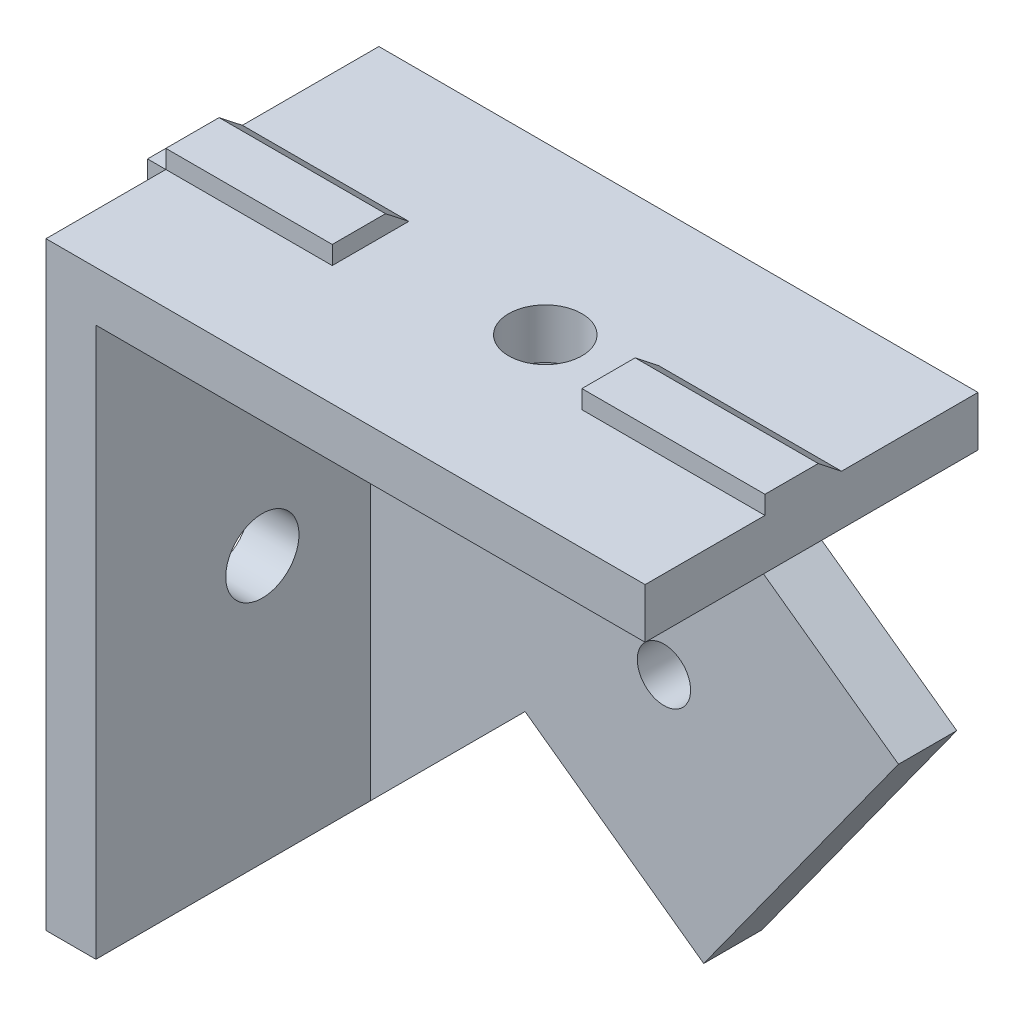
from build123d import *

# Parameters (mm, degrees)
BOSS_EXTRUDE1_DEPTH = 3.5
BOSS_EXTRUDE2_DEPTH = 16.5
SKETCH4_R           = 2.2
CUT_EXTRUDE1_DEPTH  = 53.773099208
SKETCH5_R           = 2.2
CUT_EXTRUDE2_DEPTH  = 53.773099208
BOSS_EXTRUDE5_DEPTH = 36
SKETCH7_W           = 15
SKETCH7_H           = 1.1
CUT_EXTRUDE3_DEPTH  = 53.496095093
BOSS_EXTRUDE6_REACH = 57.429
SKETCH9_W           = 1.1
SKETCH9_H           = 15
CUT_EXTRUDE4_DEPTH  = 53.496095093
BOSS_EXTRUDE7_DEPTH = 3.5
SKETCH11_R          = 1.6
CUT_EXTRUDE5_DEPTH  = 54.518688325


with BuildPart() as part:
    # Sketch1 → Boss-Extrude1 (new body)
    with BuildSketch(Plane.XY):
        Polygon((0, -36), (0, 0), (36, 0), (36, -3), (3, -36), align=None)
    extrude(amount=BOSS_EXTRUDE1_DEPTH)

    # Sketch2 → Boss-Extrude2 (add)
    with BuildSketch(Plane.XY.offset(3.5)):
        Polygon((0, -36), (0, 0), (36, 0), (36, -3), (3, -3), (3, -36), align=None)
    extrude(amount=BOSS_EXTRUDE2_DEPTH)

    # Sketch4 → Cut-Extrude1 (cut, through all)
    with BuildSketch(Plane.XZ.offset(3)):
        with Locations(Location((20, 10, 0), (0, 0, 270))):
            Circle(SKETCH4_R)
    extrude(amount=-CUT_EXTRUDE1_DEPTH, mode=Mode.SUBTRACT)

    # Sketch5 → Cut-Extrude2 (cut, through all)
    with BuildSketch(Plane(origin=(3, 0, 0), x_dir=(0, 0, -1), z_dir=(1, 0, 0))):
        with Locations((-10, -20)):
            Circle(SKETCH5_R)
    extrude(amount=-CUT_EXTRUDE2_DEPTH, mode=Mode.SUBTRACT)

    # Sketch6 → Boss-Extrude5 (add, through all)
    with BuildSketch(Plane(origin=(36, 0, 0), x_dir=(0, 0, -1), z_dir=(1, 0, 0))):
        Polygon((-12.8, 0), (-12.8, 1.1), (-9.6, 1.1), (-8.2, 0), align=None)
    extrude(amount=-BOSS_EXTRUDE5_DEPTH)

    # Sketch7 → Cut-Extrude3 (cut, through all)
    with BuildSketch(Plane.XY.offset(12.8)):
        with Locations((17.5, 0.55)):
            Rectangle(SKETCH7_W, SKETCH7_H)
    extrude(amount=-CUT_EXTRUDE3_DEPTH, mode=Mode.SUBTRACT)

    # Boss-Extrude6: up to this face of the body (flat: up to its plane)
    boss_extrude6_end = Plane(part.part.faces().sort_by_distance((0.411825206, 0, 16.4))[0])
    # Sketch8 → Boss-Extrude6 (add, up to the picked face)
    with BuildSketch(Plane.XZ.offset(36), mode=Mode.PRIVATE) as boss_extrude6_sk1:
        Polygon((0, 8.2), (0, 12.8), (-1.1, 12.8), (-1.1, 9.6), align=None)
    boss_extrude6_tool1 = split(extrude(boss_extrude6_sk1.sketch, amount=-BOSS_EXTRUDE6_REACH, mode=Mode.PRIVATE), bisect_by=boss_extrude6_end, keep=Keep.BOTH, mode=Mode.PRIVATE)
    add(boss_extrude6_tool1.solids().sort_by(Axis((-0.517094, -36, 10.82906), (0, 1, 0)))[0])

    # Sketch9 → Cut-Extrude4 (cut, through all)
    with BuildSketch(Plane.XY.offset(12.8)):
        with Locations((-0.55, -17.5)):
            Rectangle(SKETCH9_W, SKETCH9_H)
    extrude(amount=-CUT_EXTRUDE4_DEPTH, mode=Mode.SUBTRACT)

    # Sketch10 → Boss-Extrude7 (add)
    with BuildSketch(Plane.XY.offset(3.5)):
        Polygon((12.286392879, -26.713607121), (26.612382252, -12.387617748), (34.721916423, -18.238724953), (23.019702013, -34.457793296), align=None)
    extrude(amount=-BOSS_EXTRUDE7_DEPTH)

    # Sketch11 → Cut-Extrude5 (cut, through all)
    with BuildSketch(Plane.XY.offset(3.5)):
        with Locations((20.629708117, -20.629708117)):
            Circle(SKETCH11_R)
    extrude(amount=-CUT_EXTRUDE5_DEPTH, mode=Mode.SUBTRACT)


solid = part.part
